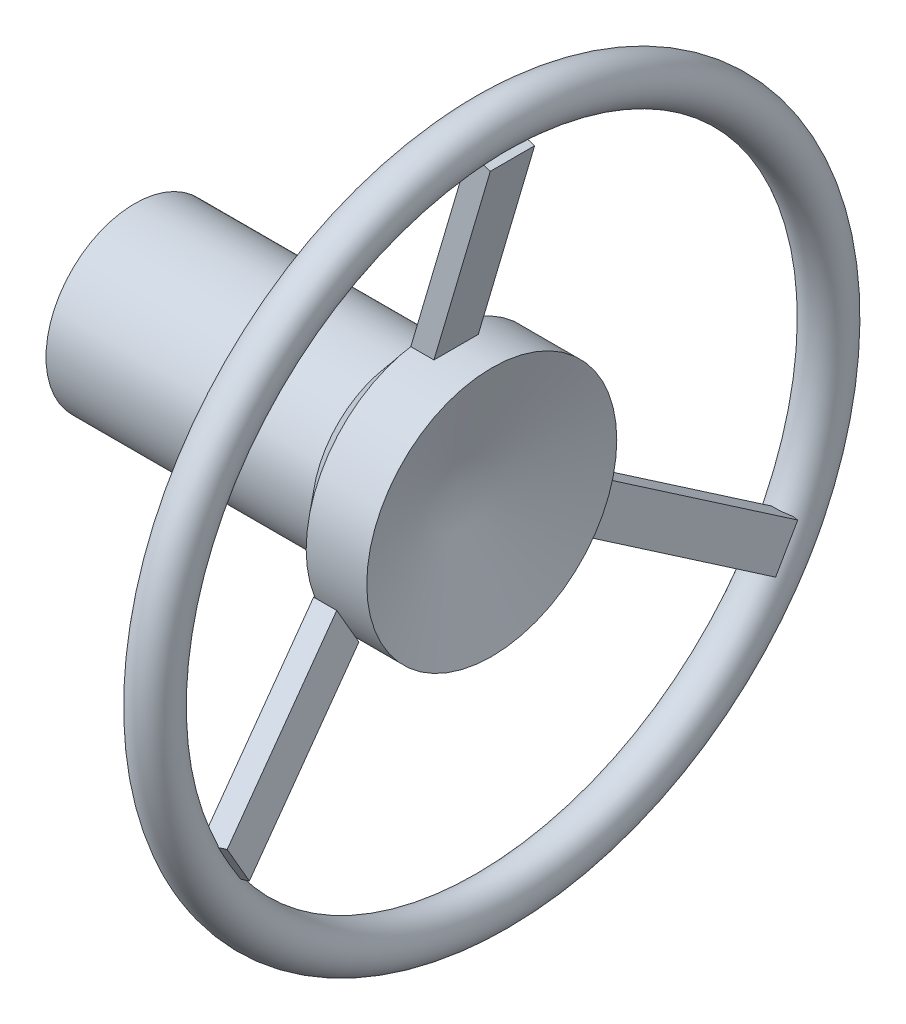
from build123d import *

# Parameters (mm, degrees)
SKETCH2_R           = 1.5
CUT_EXTRUDE1_DEPTH  = 6
SKETCH3_R           = 0.5
BOSS_EXTRUDE1_DEPTH = 0.5
CIRPATTERN1_COUNT   = 3


with BuildPart() as part:
    # Sketch1 → Revolve1 (revolve)
    with BuildSketch(Plane.XY, mode=Mode.PRIVATE) as revolve1_sk:
        Polygon((-6, 0), (0, 0), (0.687541683, 0.81938027), (2.053921281, 0.81938027), (1.153569134, -2), (-6, -2), align=None)
    revolve(revolve1_sk.sketch.rotate(Axis((1.153569134, -2, 0), (-1, 0, 0)), 90), axis=Axis((1.153569134, -2, 0), (-1, 0, 0)))

    # Sketch2 → Cut-Extrude1 (cut)
    with BuildSketch(Plane.ZY.offset(6)):
        with Locations((0, -2)):
            Circle(SKETCH2_R)
    extrude(amount=-CUT_EXTRUDE1_DEPTH, mode=Mode.SUBTRACT)


with BuildPart() as body_2:
    # Sketch3 → Revolve2 (revolve)
    with BuildSketch(Plane.XY, mode=Mode.PRIVATE) as revolve2_sk:
        with Locations((2.053921281, 5.596117166)):
            Circle(SKETCH3_R)
    revolve(revolve2_sk.sketch.rotate(Axis((-6, -2, 0), (-1, 0, 0)), 90), axis=Axis((-6, -2, 0), (-1, 0, 0)))

    # Sketch4 → Boss-Extrude1 (add, symmetric)
    with BuildSketch(Plane.XY):
        Polygon((1.2492948, 0.81938027), (2.521024293, 5.140817594), (2.041363137, 5.281974157), (0.728093538, 0.81938027), align=None)
    boss_extrude1 = extrude(amount=BOSS_EXTRUDE1_DEPTH, both=True)

    # CirPattern1: Boss-Extrude1 ×3 about axis
    cirpattern1_axis = Axis((0, -2, 0), (1, 0, 0))
    for i in range(1, CIRPATTERN1_COUNT):
        add(boss_extrude1.rotate(cirpattern1_axis, i * 360 / CIRPATTERN1_COUNT))


solid = Compound([part.part, body_2.part])
